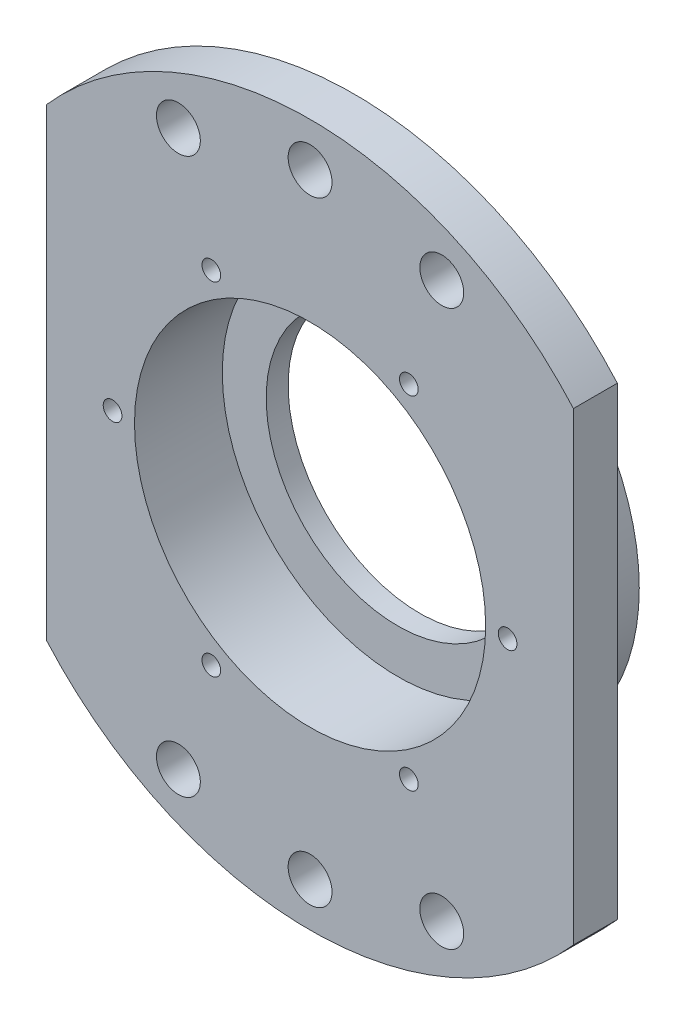
from build123d import *

# Parameters (mm, degrees)
BOSS_EXTRUDE1_DEPTH              = 6.35
SKETCH2_W                        = 31.75
SKETCH2_H                        = 9.525
F_2_4_5_TAPPED_HOLE1_D           = 38.1
F_2_4_5_TAPPED_HOLE1_CBORE_D     = 50.8
F_2_4_5_TAPPED_HOLE1_CBORE_DEPTH = 12.7
SKETCH13_R                       = 3.175
CUT_EXTRUDE1_DEPTH               = 66.454301807
CIRPATTERN1_COUNT                = 2
F_6_32_TAPPED_HOLE1_D            = 2.7051
CIRPATTERN2_COUNT                = 6
F_1_4_0_25_DIAMETER_HOLE1_D      = 6.35
F_1_4_0_25_DIAMETER_HOLE2_D      = 6.35


with BuildPart() as part:
    # Sketch1 → Boss-Extrude1 (new body)
    with BuildSketch(Plane(origin=(0, 0, 1.5875), x_dir=(-1, 0, 0), z_dir=(0, 0, -1))):
        with BuildLine():
            Line((38.1, -33.601041651), (38.1, 33.601041651))
            ThreePointArc((38.1, 33.601041651), (0, 50.8), (-38.1, 33.601041651))
            Line((-38.1, 33.601041651), (-38.1, -33.601041651))
            ThreePointArc((-38.1, -33.601041651), (0, -50.8), (38.1, -33.601041651))
        make_face()
    extrude(amount=-BOSS_EXTRUDE1_DEPTH)

    # Sketch2 → Revolve1 (revolve)
    with BuildSketch(Plane(origin=(0, 0, 0), x_dir=(1, 0, 0), z_dir=(0, 1, 0))):
        with Locations((15.875, 3.175)):
            Rectangle(SKETCH2_W, SKETCH2_H)
    revolve(axis=Axis((0, 0, -7.9375), (0, 0, 1)))

    # 2-4.5 Tapped Hole1 (through all)
    with Locations(Plane.XY.offset(7.9375)):
        with Locations((0, 0)):
            CounterBoreHole(F_2_4_5_TAPPED_HOLE1_D / 2, F_2_4_5_TAPPED_HOLE1_CBORE_D / 2, F_2_4_5_TAPPED_HOLE1_CBORE_DEPTH)

    # Sketch13 → Cut-Extrude1 (cut, through all)
    with BuildSketch(Plane.XY.offset(7.9375)):
        with Locations((0, 44.45)):
            Circle(SKETCH13_R)
    cut_extrude1 = extrude(amount=-CUT_EXTRUDE1_DEPTH, mode=Mode.SUBTRACT)

    # CirPattern1: Cut-Extrude1 ×2 about axis
    cirpattern1_axis = Axis((0, 0, 0), (0, 0, 1))
    for i in range(1, CIRPATTERN1_COUNT):
        add(cut_extrude1.rotate(cirpattern1_axis, i * 360 / CIRPATTERN1_COUNT), mode=Mode.SUBTRACT)

    # #6-32 Tapped Hole1 (through all)
    with Locations(Plane.XY.offset(7.9375)):
        with Locations((28.575, 0)):
            f_6_32_tapped_hole1 = Hole(F_6_32_TAPPED_HOLE1_D / 2)

    # CirPattern2: #6-32 Tapped Hole1 ×6 about axis
    cirpattern2_axis = Axis((0, 0, 0), (0, 0, 1))
    for i in range(1, CIRPATTERN2_COUNT):
        add(f_6_32_tapped_hole1.rotate(cirpattern2_axis, i * 360 / CIRPATTERN2_COUNT), mode=Mode.SUBTRACT)

    # 1/4 (0.25) Diameter Hole1 (through all)
    with Locations(Plane.XY.offset(7.9375)):
        with Locations((-19.05, 40.160926284)):
            Hole(F_1_4_0_25_DIAMETER_HOLE1_D / 2)

    # 1/4 (0.25) Diameter Hole2 (through all)
    with Locations(Plane.XY.offset(7.9375)):
        with Locations((19.05, 40.160926284), (19.05, -40.160926284), (-19.05, -40.160926284)):
            Hole(F_1_4_0_25_DIAMETER_HOLE2_D / 2)


solid = part.part
